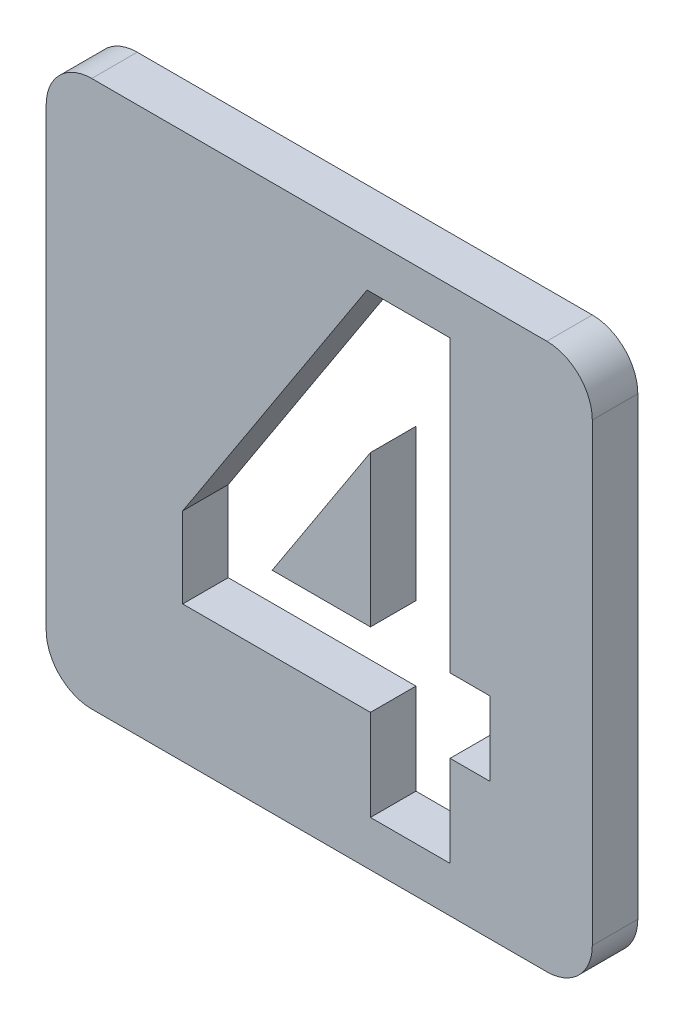
from build123d import *

# Parameters (mm, degrees)
BOSS_EXTRUDE1_DEPTH = 10
CUT_EXTRUDE2_DEPTH  = 10


with BuildPart() as part:
    # Sketch1 → Boss-Extrude1 (new body)
    with BuildSketch(Plane.XY):
        with BuildLine():
            Line((-50, 60), (50, 60))
            ThreePointArc((50, 60), (57.071067812, 57.071067812), (60, 50))
            Line((60, 50), (60, -50))
            ThreePointArc((60, -50), (57.071067812, -57.071067812), (50, -60))
            Line((50, -60), (-50, -60))
            ThreePointArc((-50, -60), (-57.071067812, -57.071067812), (-60, -50))
            Line((-60, -50), (-60, 50))
            ThreePointArc((-60, 50), (-57.071067812, 57.071067812), (-50, 60))
        make_face()
    extrude(amount=BOSS_EXTRUDE1_DEPTH)

    # Sketch2 → Cut-Extrude2 (cut)
    with BuildSketch(Plane.XY.offset(10)):
        Polygon((10.5078125, 50), (28.75, 50), (28.75, -13.75), (37.5, -13.75), (37.5, -30), (28.75, -30), (28.75, -50), (11.25, -50), (11.25, -30), (-30, -30), (-30, -12.28515625), align=None)
        Polygon((11.25, -13.75), (11.25, 19.43359375), (-10.33203125, -13.75), align=None, mode=Mode.SUBTRACT)
    extrude(amount=-CUT_EXTRUDE2_DEPTH, mode=Mode.SUBTRACT)


with BuildPart() as cut_extrude2_piece_1:
    # of the separate pieces the step leaves, piece 1, a body of its own (cut_extrude2_pieces)
    add(part.part.solids().sort_by_distance((-50, 60, 0))[0])


with BuildPart() as cut_extrude2_piece_2:
    # of the separate pieces the step leaves, piece 2, a body of its own (cut_extrude2_pieces)
    add(part.part.solids().sort_by_distance((11.25, -13.75, 0))[0])


solid = Compound([cut_extrude2_piece_1.part, cut_extrude2_piece_2.part])
